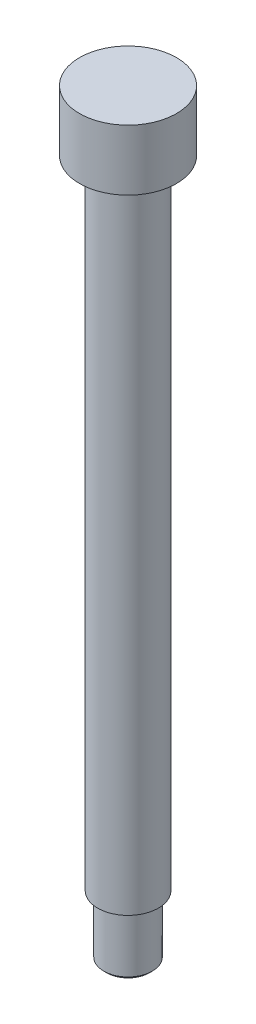
from build123d import *

# Parameters (mm, degrees)
CHAMFER1_SIZE = 0.5


with BuildPart() as part:
    # Sketch1 → Revolve1 (revolve)
    with BuildSketch(Plane.XY, mode=Mode.PRIVATE) as revolve1_sk:
        Polygon((0, 0), (8, 0), (8, -10), (5, -10), (5, -115), (4, -115), (4, -125), (0, -125), align=None)
    revolve(revolve1_sk.sketch.rotate(Axis((0, -130, 0), (0, 1, 0)), 90), axis=Axis((0, -130, 0), (0, 1, 0)))

    # Chamfer1
    chamfer1_edges = [part.edges().sort_by_distance(p)[0] for p in [
        (0, -125, 4),
    ]]
    chamfer(chamfer1_edges, length=CHAMFER1_SIZE)


solid = part.part
